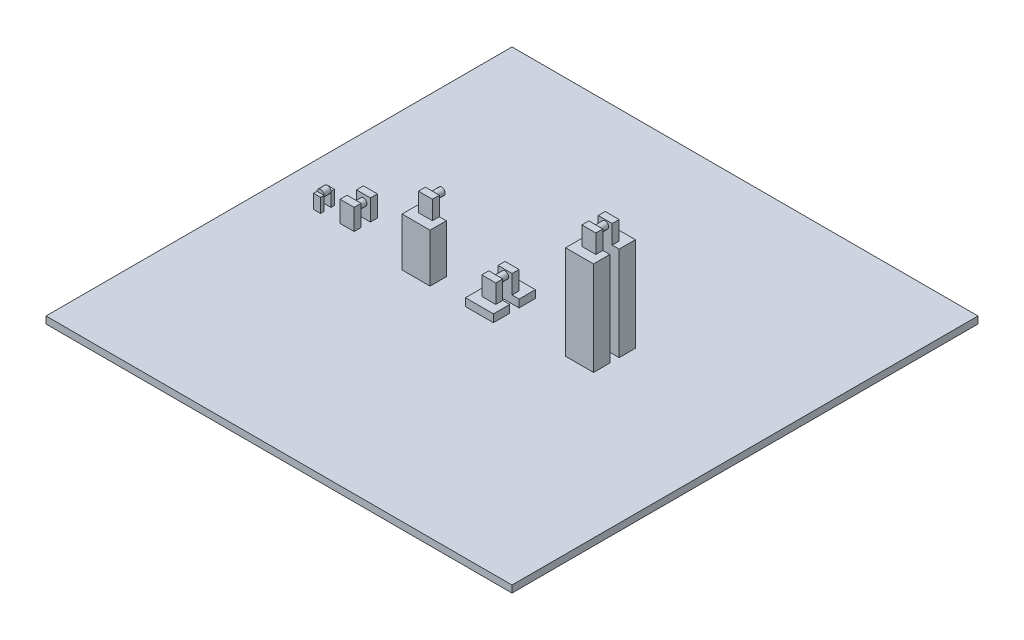
from build123d import *

# Parameters (mm, degrees)
SKETCH_1_W             = 100
SKETCH_1_H             = 100
EXTRUDE_1_DEPTH        = 1.5
SKETCH_2_R             = 0.75
EXTRUDE_2_DEPTH        = 0.75
SKETCH_3_W             = 1.5
SKETCH_3_H             = 3
EXTRUDE_3_DEPTH        = 1.5
SKETCH_5_W             = 3
SKETCH_5_H             = 1.5
EXTRUDE_4_DEPTH        = 3
SKETCH_7_R             = 0.75
EXTRUDE_5_DEPTH        = 2.5
SKETCH_8_W             = 6
SKETCH_8_H             = 9
EXTRUDE_6_DEPTH        = 10.4
SKETCH_9_W             = 3
SKETCH_9_H             = 1.5
EXTRUDE_7_DEPTH        = 4
SKETCH_10_R            = 0.75
EXTRUDE_8_DEPTH        = 3
SKETCH_11_W            = 6
SKETCH_11_H            = 2
CUT_EXTRUDE_1_DEPTH    = 10.4
SKETCH_12_W            = 6
SKETCH_12_H            = 3.5
EXTRUDE_9_DEPTH        = 20.17
SKETCH_13_W            = 3
SKETCH_13_H            = 1.5
EXTRUDE_10_DEPTH       = 4
SKETCH_14_R            = 0.75
EXTRUDE_11_DEPTH       = 2
PATTERN_LINEAR_2_COUNT = 2
PATTERN_LINEAR_2_PITCH = 13.6
SKETCH_16_W            = 6
SKETCH_16_H            = 8.75
CUT_EXTRUDE_2_DEPTH    = 9.25
SKETCH_17_W            = 6
SKETCH_17_H            = 2
CUT_EXTRUDE_3_DEPTH    = 1.65
SKETCH_18_W            = 3
SKETCH_18_H            = 1.5
EXTRUDE_12_DEPTH       = 4
SKETCH_19_R            = 0.75
EXTRUDE_13_DEPTH       = 3
EXTRUDE_14_DEPTH       = 1.5
SKETCH_21_W            = 0.75
SKETCH_21_H            = 3
CUT_EXTRUDE_4_DEPTH    = 1.5
SKETCH_22_W            = 1.5
SKETCH_22_H            = 0.5
EXTRUDE_15_DEPTH       = 2.5
SKETCH_23_W            = 3.5
SKETCH_23_H            = 14.4
CUT_EXTRUDE_5_DEPTH    = 6


with BuildPart() as part:
    # 草圖1 → 填料-伸長1 (new body)
    with BuildSketch(Plane(origin=(0, 0, 0), x_dir=(1, 0, 0), z_dir=(0, 1, 0))):
        Rectangle(SKETCH_1_W, SKETCH_1_H)
    extrude(amount=EXTRUDE_1_DEPTH)



with BuildPart() as body_2:
    # 草圖2 → 填料-伸長2 (new, symmetric)
    with BuildSketch(Plane.XY):
        with Locations((-40.336831864, 4.5)):
            Circle(SKETCH_2_R)
    extrude(amount=EXTRUDE_2_DEPTH, both=True)


with BuildPart() as part_1:
    add(part.part)

    add(body_2.part)  # 填料-伸長3 merges body 2
    # 草圖3 → 填料-伸長3 (add)
    with BuildSketch(Plane.XY.offset(0.75)):
        with Locations((-40.336831864, 3)):
            Rectangle(SKETCH_3_W, SKETCH_3_H)
    extrude_3 = extrude(amount=EXTRUDE_3_DEPTH)

    # 鏡射1: 填料-伸長3 across plane
    add(extrude_3.mirror(Plane.XY))

    # 草圖5 → 填料-伸長4 (add)
    with BuildSketch(Plane(origin=(0, 4.5, 0), x_dir=(1, 0, 0), z_dir=(0, 1, 0))):
        with Locations((-34.136831864, -0.5)):
            Rectangle(SKETCH_5_W, SKETCH_5_H)
        with Locations((-34.136831864, 3)):
            Rectangle(SKETCH_5_W, SKETCH_5_H)
    extrude(amount=-EXTRUDE_4_DEPTH)

    # 草圖7 → 填料-伸長5 (add)
    with BuildSketch(Plane.XY.offset(-2.25)):
        with Locations(Location((-34.136831864, 4.5, 0), (0, 0, 180))):
            Circle(SKETCH_7_R)
    extrude(amount=EXTRUDE_5_DEPTH)

    # 草圖8 → 填料-伸長6 (add)
    with BuildSketch(Plane(origin=(0, 1.5, 0), x_dir=(1, 0, 0), z_dir=(0, 1, 0))):
        with Locations((-17.336831864, 1.25)):
            Rectangle(SKETCH_8_W, SKETCH_8_H)
    extrude_6 = extrude(amount=EXTRUDE_6_DEPTH)

    # 草圖9 → 填料-伸長7 (add)
    with BuildSketch(Plane(origin=(0, 11.9, 0), x_dir=(1, 0, 0), z_dir=(0, 1, 0))):
        with Locations((-17.336831864, 3)):
            Rectangle(SKETCH_9_W, SKETCH_9_H)
        with Locations((-17.336831864, -0.5)):
            Rectangle(SKETCH_9_W, SKETCH_9_H)
    extrude(amount=EXTRUDE_7_DEPTH)

    # 草圖10 → 填料-伸長8 (add)
    with BuildSketch(Plane.XY.offset(-2.25)):
        with Locations(Location((-17.336831864, 14.9, 0), (0, 0, 180))):
            Circle(SKETCH_10_R)
    extrude(amount=EXTRUDE_8_DEPTH)

    # 草圖11 → 除料-伸長1 (cut)
    with BuildSketch(Plane(origin=(0, 11.9, 0), x_dir=(1, 0, 0), z_dir=(0, 1, 0))):
        with Locations((-17.336831864, 1.25)):
            Rectangle(SKETCH_11_W, SKETCH_11_H)
    extrude(amount=-CUT_EXTRUDE_1_DEPTH, mode=Mode.SUBTRACT)

    # 草圖12 → 填料-伸長9 (add)
    with BuildSketch(Plane(origin=(0, 1.5, 0), x_dir=(1, 0, 0), z_dir=(0, 1, 0))):
        with Locations((16.243168136, 0)):
            Rectangle(SKETCH_12_W, SKETCH_12_H)
        with Locations((16.243168136, 5.5)):
            Rectangle(SKETCH_12_W, SKETCH_12_H)
    extrude(amount=EXTRUDE_9_DEPTH)

    # 草圖13 → 填料-伸長10 (add)
    with BuildSketch(Plane(origin=(0, 21.67, 0), x_dir=(1, 0, 0), z_dir=(0, 1, 0))):
        with Locations((16.243168136, 1)):
            Rectangle(SKETCH_13_W, SKETCH_13_H)
        with Locations((16.243168136, 4.5)):
            Rectangle(SKETCH_13_W, SKETCH_13_H)
    extrude(amount=EXTRUDE_10_DEPTH)

    # 草圖14 → 填料-伸長11 (add)
    with BuildSketch(Plane.XY.offset(-3.75)):
        with Locations(Location((16.243168136, 24.67, 0), (0, 0, 180))):
            Circle(SKETCH_14_R)
    extrude(amount=EXTRUDE_11_DEPTH)

    # 直線複製排列2: 填料-伸長6 ×2
    with Locations(*[(i * PATTERN_LINEAR_2_PITCH, 0, 0) for i in range(1, PATTERN_LINEAR_2_COUNT)]):
        add(extrude_6)

    # 草圖16 → 除料-伸長2 (cut, symmetric)
    with BuildSketch(Plane.XY):
        with Locations((-3.736831864, 7.525)):
            Rectangle(SKETCH_16_W, SKETCH_16_H)
    extrude(amount=CUT_EXTRUDE_2_DEPTH, both=True, mode=Mode.SUBTRACT)

    # 草圖17 → 除料-伸長3 (cut)
    with BuildSketch(Plane(origin=(0, 3.15, 0), x_dir=(1, 0, 0), z_dir=(0, 1, 0))):
        with Locations((-3.736831864, 1.25)):
            Rectangle(SKETCH_17_W, SKETCH_17_H)
    extrude(amount=-CUT_EXTRUDE_3_DEPTH, mode=Mode.SUBTRACT)

    # 草圖18 → 填料-伸長12 (add)
    with BuildSketch(Plane(origin=(0, 3.15, 0), x_dir=(1, 0, 0), z_dir=(0, 1, 0))):
        with Locations((-3.736831864, 3)):
            Rectangle(SKETCH_18_W, SKETCH_18_H)
        with Locations((-3.736831864, -0.5)):
            Rectangle(SKETCH_18_W, SKETCH_18_H)
    extrude(amount=EXTRUDE_12_DEPTH)

    # 草圖19 → 填料-伸長13 (add)
    with BuildSketch(Plane.XY.offset(-2.25)):
        with Locations(Location((-3.736831864, 6.15, 0), (0, 0, 180))):
            Circle(SKETCH_19_R)
    extrude(amount=EXTRUDE_13_DEPTH)

    # 草圖20 → 填料-伸長14 (add)
    with BuildSketch(Plane(origin=(0, 4.5, 0), x_dir=(1, 0, 0), z_dir=(0, 1, 0))):
        Polygon((-32.636831864, 0.25), (-33.386831864, 0.25), (-33.386831864, -0.25), (-34.886831864, -0.25), (-34.886831864, 0.25), (-35.636831864, 0.25), (-35.636831864, -1.25), (-32.636831864, -1.25), align=None)
        Polygon((-35.636831864, 3.75), (-35.636831864, 2.25), (-34.886831864, 2.25), (-33.386831864, 2.25), (-32.636831864, 2.25), (-32.636831864, 3.75), align=None)
    extrude(amount=EXTRUDE_14_DEPTH)

    # 草圖21 → 除料-伸長4 (cut)
    with BuildSketch(Plane.ZY.offset(41.086831864)):
        with Locations((1.875, 3)):
            Rectangle(SKETCH_21_W, SKETCH_21_H)
        with Locations((-1.875, 3)):
            Rectangle(SKETCH_21_W, SKETCH_21_H)
    extrude(amount=-CUT_EXTRUDE_4_DEPTH, mode=Mode.SUBTRACT)

    # 草圖22 → 填料-伸長15 (add)
    with BuildSketch(Plane(origin=(0, 6, 0), x_dir=(1, 0, 0), z_dir=(0, 1, 0))):
        with Locations((-34.136831864, 0)):
            Rectangle(SKETCH_22_W, SKETCH_22_H)
    extrude(amount=-EXTRUDE_15_DEPTH)

    # 草圖23 → 除料-伸長5 (cut)
    with BuildSketch(Plane.ZY.offset(20.336831864)):
        with Locations((-4, 8.7)):
            Rectangle(SKETCH_23_W, SKETCH_23_H)
    extrude(amount=-CUT_EXTRUDE_5_DEPTH, mode=Mode.SUBTRACT)


solid = part_1.part
